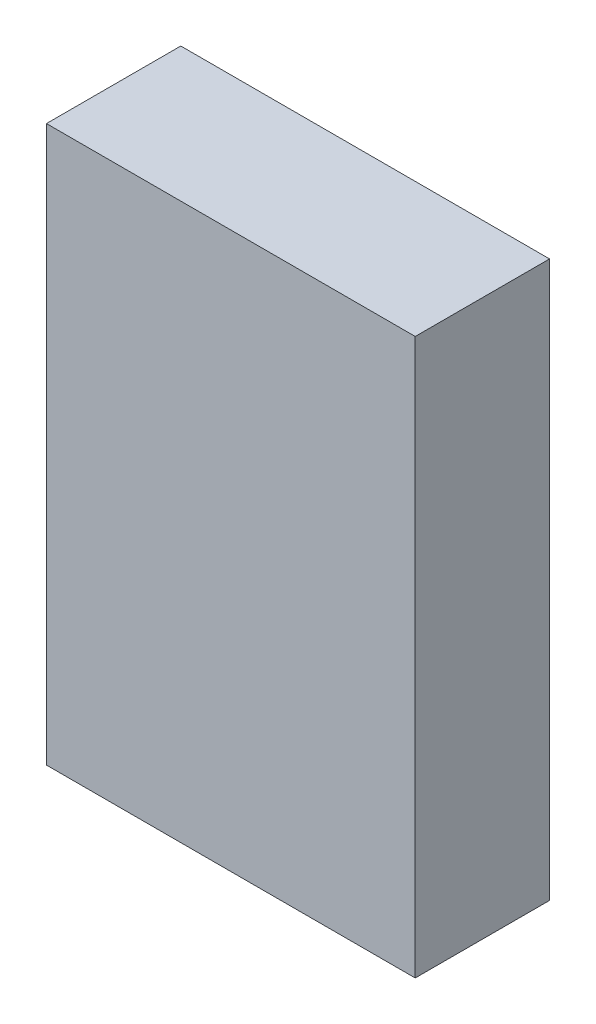
from build123d import *

# Parameters (mm, degrees)
CROQUIS1_W              = 60.4
CROQUIS1_H              = 91
SALIENTE_EXTRUIR1_DEPTH = 22


with BuildPart() as part:
    # Croquis1 → Saliente-Extruir1 (new body)
    with BuildSketch(Plane.XY):
        with Locations((-34.482646211, -0.673854515)):
            Rectangle(CROQUIS1_W, CROQUIS1_H)
    extrude(amount=SALIENTE_EXTRUIR1_DEPTH)


solid = part.part
